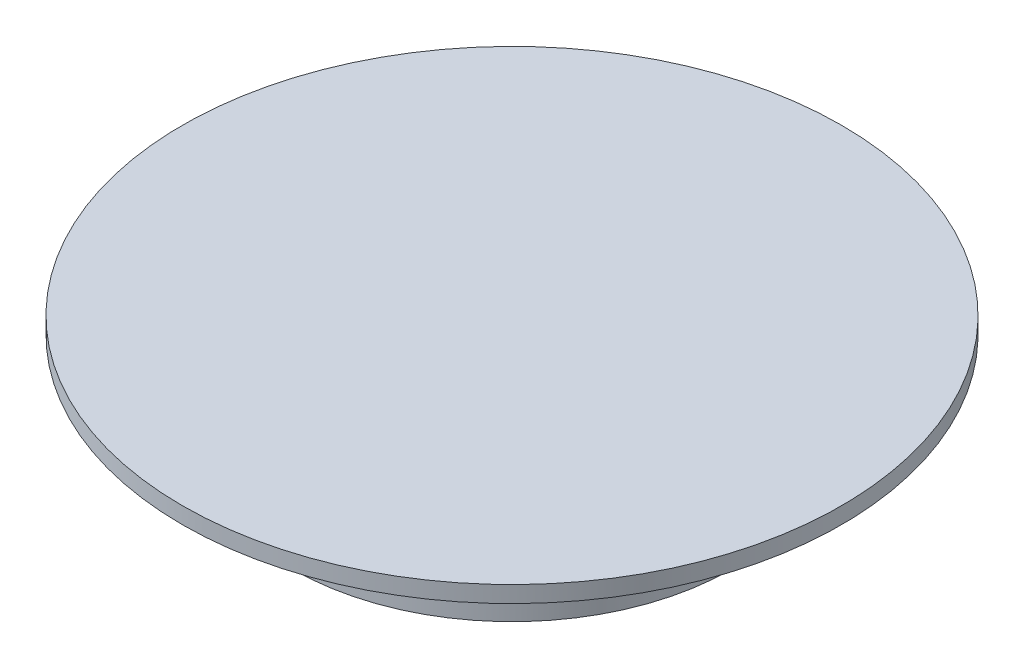
from build123d import *

# Parameters (mm, degrees)
FILLET1_R = 3


with BuildPart() as part:
    # Sketch1 → Revolve1 (revolve)
    with BuildSketch(Plane.XY, mode=Mode.PRIVATE) as revolve1_sk:
        Polygon((-40, 20), (-60, 20), (-60, 17), (-40, 17), (-40, 0), (-35, 0), (-35, 17), (0, 17), (0, 20), align=None)
    revolve(revolve1_sk.sketch.rotate(Axis((0, -63.953488372, 0), (0, 1, 0)), 270), axis=Axis((0, -63.953488372, 0), (0, 1, 0)))

    # Fillet1
    fillet1_edges = [part.edges().sort_by_distance(p)[0] for p in [
        (0, 17, 40),
    ]]
    fillet(fillet1_edges, radius=FILLET1_R)


solid = part.part
